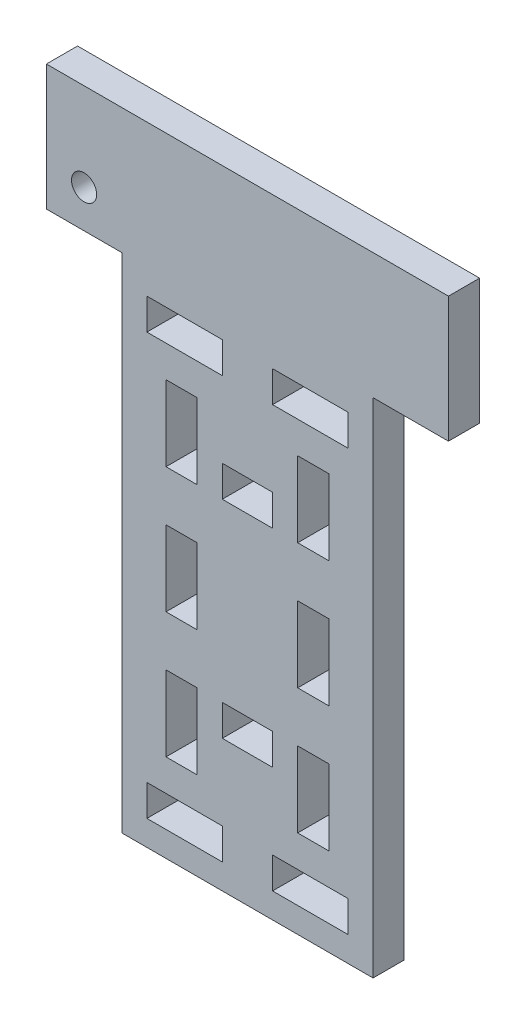
from build123d import *

# Parameters (mm, degrees)
MODEL_R             = 5
MODEL_W             = 12.4
MODEL_H             = 30
MODEL_W_2           = 20
MODEL_H_2           = 12.4
MODEL_W_3           = 30
BOSS_EXTRUDE1_DEPTH = 12.4


with BuildPart() as part:
    # Model → Boss-Extrude1 (new body)
    with BuildSketch(Plane.XY):
        Polygon((50, 200), (80, 200), (80, 250), (-80, 250), (-80, 200), (-50, 200), (-50, 0), (50, 0), align=None)
        with Locations(Location((-65, 215, 0), (0, 0, 180))):
            Circle(MODEL_R, mode=Mode.SUBTRACT)
        with Locations((-26.2, 150)):
            Rectangle(MODEL_W, MODEL_H, mode=Mode.SUBTRACT)
        with Locations((-26.2, 100)):
            Rectangle(MODEL_W, MODEL_H, mode=Mode.SUBTRACT)
        with Locations((-26.2, 50)):
            Rectangle(MODEL_W, MODEL_H, mode=Mode.SUBTRACT)
        with Locations((26.2, 50)):
            Rectangle(MODEL_W, MODEL_H, mode=Mode.SUBTRACT)
        with Locations((26.2, 150)):
            Rectangle(MODEL_W, MODEL_H, mode=Mode.SUBTRACT)
        with Locations((26.2, 100)):
            Rectangle(MODEL_W, MODEL_H, mode=Mode.SUBTRACT)
        with Locations((0, 141.2)):
            Rectangle(MODEL_W_2, MODEL_H_2, mode=Mode.SUBTRACT)
        with Locations((0, 58.8)):
            Rectangle(MODEL_W_2, MODEL_H_2, mode=Mode.SUBTRACT)
        with Locations((25, 16.2)):
            Rectangle(MODEL_W_3, MODEL_H_2, mode=Mode.SUBTRACT)
        with Locations((-25, 16.2)):
            Rectangle(MODEL_W_3, MODEL_H_2, mode=Mode.SUBTRACT)
        with Locations((25, 183.8)):
            Rectangle(MODEL_W_3, MODEL_H_2, mode=Mode.SUBTRACT)
        with Locations((-25, 183.8)):
            Rectangle(MODEL_W_3, MODEL_H_2, mode=Mode.SUBTRACT)
    extrude(amount=BOSS_EXTRUDE1_DEPTH)


solid = part.part
